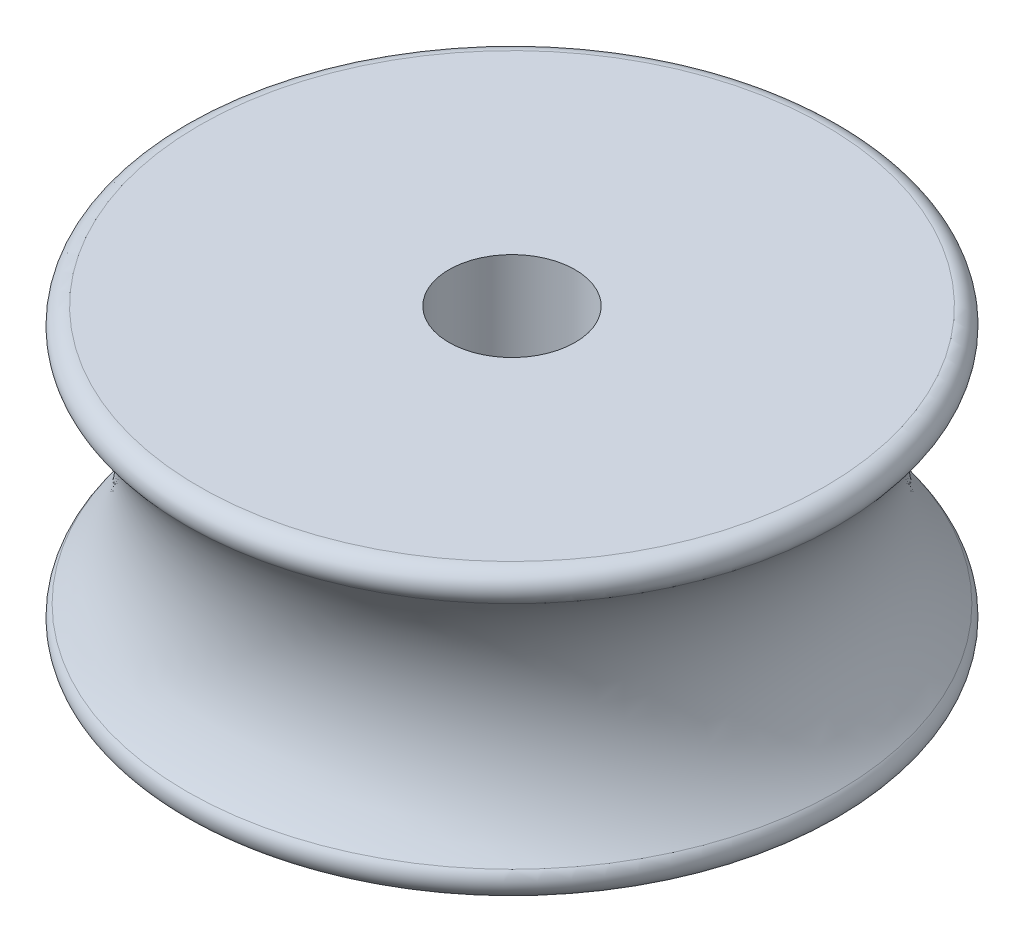
from build123d import *

# Parameters (mm, degrees)
FILLET3_R = 0.7


with BuildPart() as part:
    # Sketch1 → Revolve1 (revolve)
    with BuildSketch(Plane.XY, mode=Mode.PRIVATE) as revolve1_sk:
        with BuildLine():
            Line((2.979949748, -6), (15.35, -6))
            Line((15.35, -6), (15.35, 6))
            Line((15.35, 6), (2.979949748, 6))
            ThreePointArc((2.979949748, 6), (6.2, 0), (2.979949748, -6))
        make_face()
    revolve(revolve1_sk.sketch.rotate(Axis((18, -6, 0), (0, 1, 0)), 180), axis=Axis((18, -6, 0), (0, 1, 0)))

    # Fillet3
    fillet3_edges = [part.edges().sort_by_distance(p)[0] for p in [
        (2.979949748, 6, 0),
        (2.979949748, -6, 0),
    ]]
    fillet(fillet3_edges, radius=FILLET3_R)


solid = part.part
